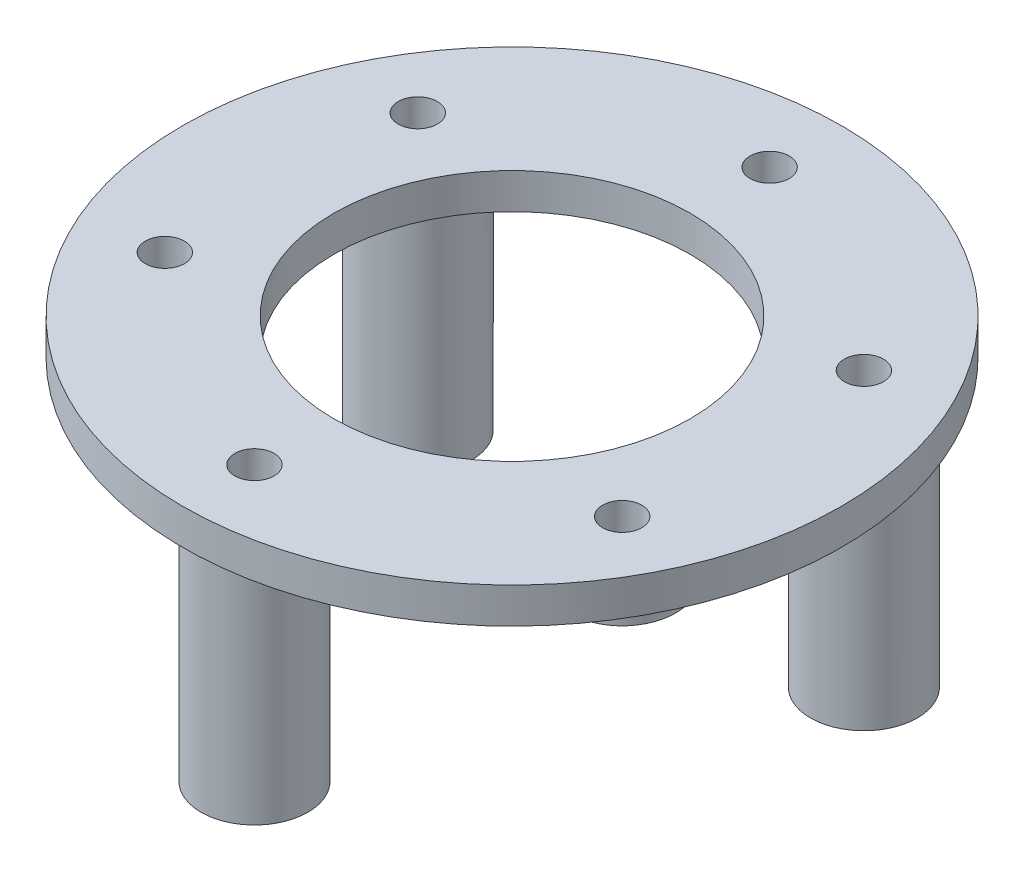
from build123d import *

# Parameters (mm, degrees)
SKETCH_1_R          = 18.5
SKETCH_1_R_2        = 10
SKETCH_1_R_3        = 1.1
EXTRUDE_1_DEPTH     = 2
EXTRUDE_START       = -3.2
SKETCH_2_R          = 3
SKETCH_2_R_2        = 1.1
EXTRUDE_2_DEPTH     = 1.2
SKETCH_3_R          = 1.1
CUT_EXTRUDE_1_DEPTH = 27.357921011
SKETCH_4_R          = 3
SKETCH_4_R_2        = 1.1
EXTRUDE_3_DEPTH     = 13.4
CUT_EXTRUDE_2_DEPTH = 0.44


with BuildPart() as part:
    # Эскиз1 → Бобышка-Вытянуть1 (new body)
    with BuildSketch(Plane(origin=(0, 0, 0), x_dir=(1, 0, 0), z_dir=(0, 1, 0))):
        with Locations(Location((0, 0, 0), (0, 0, 270))):
            Circle(SKETCH_1_R)
        with Locations(Location((0, 0, 0), (0, 0, 270))):
            Circle(SKETCH_1_R_2, mode=Mode.SUBTRACT)
        with Locations(Location((0, 14.46, 0), (0, 0, 270))):
            Circle(SKETCH_1_R_3, mode=Mode.SUBTRACT)
        with Locations(Location((12.837810469, -6.654488888, 0), (0, 0, 270))):
            Circle(SKETCH_1_R_3, mode=Mode.SUBTRACT)
        with Locations(Location((-12.837810469, -6.654488888, 0), (0, 0, 270))):
            Circle(SKETCH_1_R_3, mode=Mode.SUBTRACT)
    extrude(amount=EXTRUDE_1_DEPTH)

    # Эскиз2 → Бобышка-Вытянуть2 (add)
    # profile 1 of 3: a face of its own
    with BuildSketch(Plane(origin=(0, 2, 0), x_dir=(1, 0, 0), z_dir=(0, 1, 0)).offset(EXTRUDE_START)):
        with Locations(Location((0, 14.46, 0), (0, 0, 270))):
            Circle(SKETCH_2_R)
        with Locations(Location((0, 14.46, 0), (0, 0, 270))):
            Circle(SKETCH_2_R_2, mode=Mode.SUBTRACT)
    # profile 2 of 3: a face of its own
    with BuildSketch(Plane(origin=(0, 2, 0), x_dir=(1, 0, 0), z_dir=(0, 1, 0)).offset(EXTRUDE_START)):
        with Locations(Location((-12.837810469, -6.654488888, 0), (0, 0, 270))):
            Circle(SKETCH_2_R)
        with Locations(Location((-12.837810469, -6.654488888, 0), (0, 0, 270))):
            Circle(SKETCH_2_R_2, mode=Mode.SUBTRACT)
    # profile 3 of 3: a face of its own
    with BuildSketch(Plane(origin=(0, 2, 0), x_dir=(1, 0, 0), z_dir=(0, 1, 0)).offset(EXTRUDE_START)):
        with Locations(Location((12.837810469, -6.654488888, 0), (0, 0, 270))):
            Circle(SKETCH_2_R)
        with Locations(Location((12.837810469, -6.654488888, 0), (0, 0, 270))):
            Circle(SKETCH_2_R_2, mode=Mode.SUBTRACT)
    extrude(amount=EXTRUDE_2_DEPTH)

    # Эскиз3 → Вырез-Вытянуть1 (cut, through all)
    with BuildSketch(Plane(origin=(0, 2, 0), x_dir=(1, 0, 0), z_dir=(0, 1, 0))):
        with Locations(Location((-12.522727339, 7.23, 0), (0, 0, 270))):
            Circle(SKETCH_3_R)
        with Locations(Location((12.522727339, 7.23, 0), (0, 0, 270))):
            Circle(SKETCH_3_R)
        with Locations(Location((0, -14.46, 0), (0, 0, 270))):
            Circle(SKETCH_3_R)
    extrude(amount=-CUT_EXTRUDE_1_DEPTH, mode=Mode.SUBTRACT)

    # Эскиз4 → Бобышка-Вытянуть3 (add)
    # profile 1 of 3: a face of its own
    with BuildSketch(Plane.XZ):
        with Locations(Location((-12.522727339, -7.23, 0), (0, 0, 90))):
            Circle(SKETCH_4_R)
        with Locations(Location((-12.522727339, -7.23, 0), (0, 0, 90))):
            Circle(SKETCH_4_R_2, mode=Mode.SUBTRACT)
    # profile 2 of 3: a face of its own
    with BuildSketch(Plane.XZ):
        with Locations(Location((0, 14.46, 0), (0, 0, 90))):
            Circle(SKETCH_4_R)
        with Locations(Location((0, 14.46, 0), (0, 0, 90))):
            Circle(SKETCH_4_R_2, mode=Mode.SUBTRACT)
    # profile 3 of 3: a face of its own
    with BuildSketch(Plane.XZ):
        with Locations(Location((12.522727339, -7.23, 0), (0, 0, 90))):
            Circle(SKETCH_4_R)
        with Locations(Location((12.522727339, -7.23, 0), (0, 0, 90))):
            Circle(SKETCH_4_R_2, mode=Mode.SUBTRACT)
    extrude(amount=EXTRUDE_3_DEPTH)

    # Эскиз5 → Вырез-Вытянуть2 (cut)
    with BuildSketch(Plane.XZ):
        Polygon((-8.383974596, -16.52146997), (-6.383974596, -13.057368355), (-8.116025404, -12.057368355), (-10.116025404, -15.52146997), align=None)
    extrude(amount=-CUT_EXTRUDE_2_DEPTH, mode=Mode.SUBTRACT)


solid = part.part
